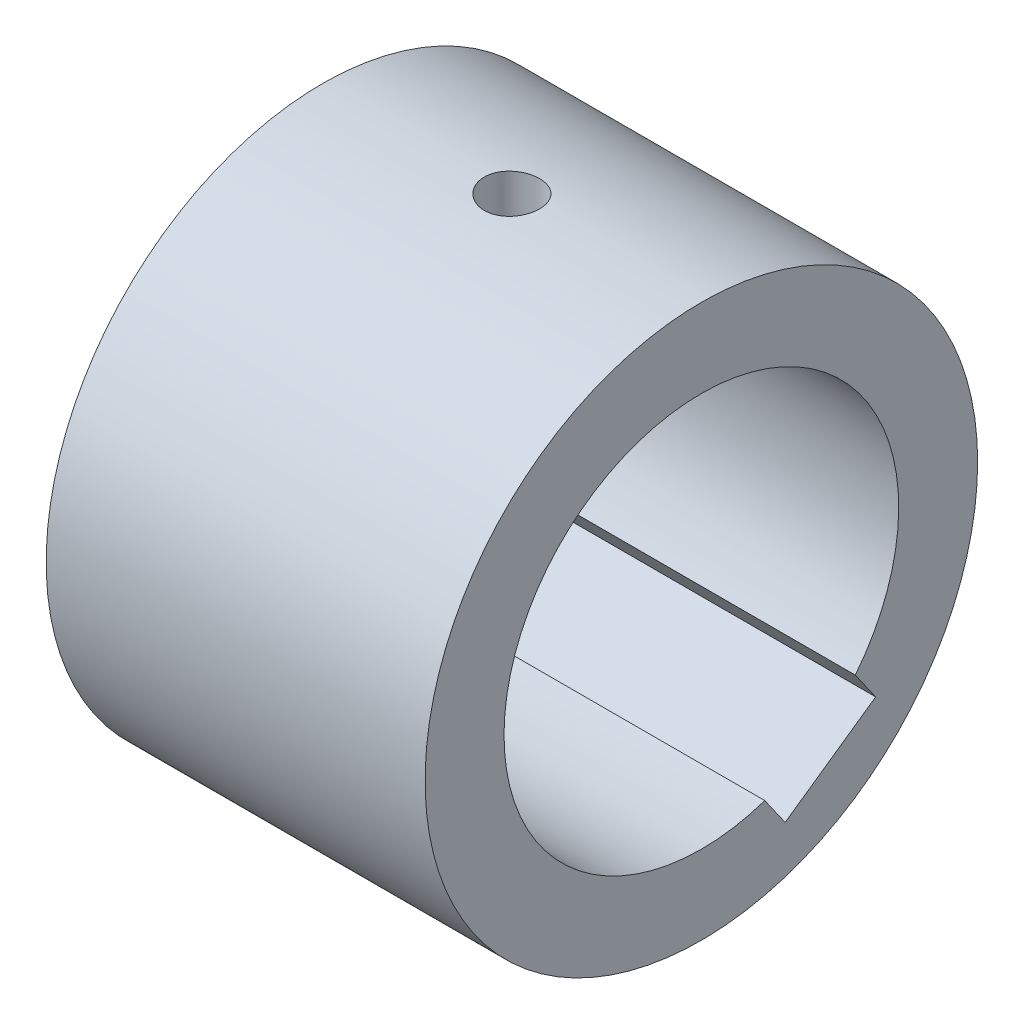
from build123d import *

# Parameters (mm, degrees)
SKETCH1_R           = 35
SKETCH1_R_2         = 25
BOSS_EXTRUDE1_DEPTH = 24
CUT_EXTRUDE2_DEPTH  = 69.949256704
SKETCH6_R           = 3.5
CUT_EXTRUDE3_DEPTH  = 24


with BuildPart() as part:
    # Sketch1 → Boss-Extrude1 (new, symmetric)
    with BuildSketch(Plane(origin=(0, 0, 0), x_dir=(0, 0, -1), z_dir=(1, 0, 0))):
        Circle(SKETCH1_R)
        Circle(SKETCH1_R_2, mode=Mode.SUBTRACT)
    extrude(amount=BOSS_EXTRUDE1_DEPTH, both=True)

    # Sketch5 → Cut-Extrude2 (cut, through all)
    with BuildSketch(Plane(origin=(24, 0, 0), x_dir=(0, 0, -1), z_dir=(1, 0, 0))):
        Polygon((22.080992746, -19.330798208), (10.612864126, -27.360868317), (2.618348192, -15.943516321), (14.086476812, -7.913446212), align=None)
    extrude(amount=-CUT_EXTRUDE2_DEPTH, mode=Mode.SUBTRACT)

    # Sketch6 → Cut-Extrude3 (cut)
    with BuildSketch(Plane(origin=(0, 35, 0), x_dir=(-1, 0, 0), z_dir=(0, 1, 0))):
        with Locations(Location((0, 0, 0), (0, 0, 90))):
            Circle(SKETCH6_R)
    extrude(amount=-CUT_EXTRUDE3_DEPTH, mode=Mode.SUBTRACT)


solid = part.part
